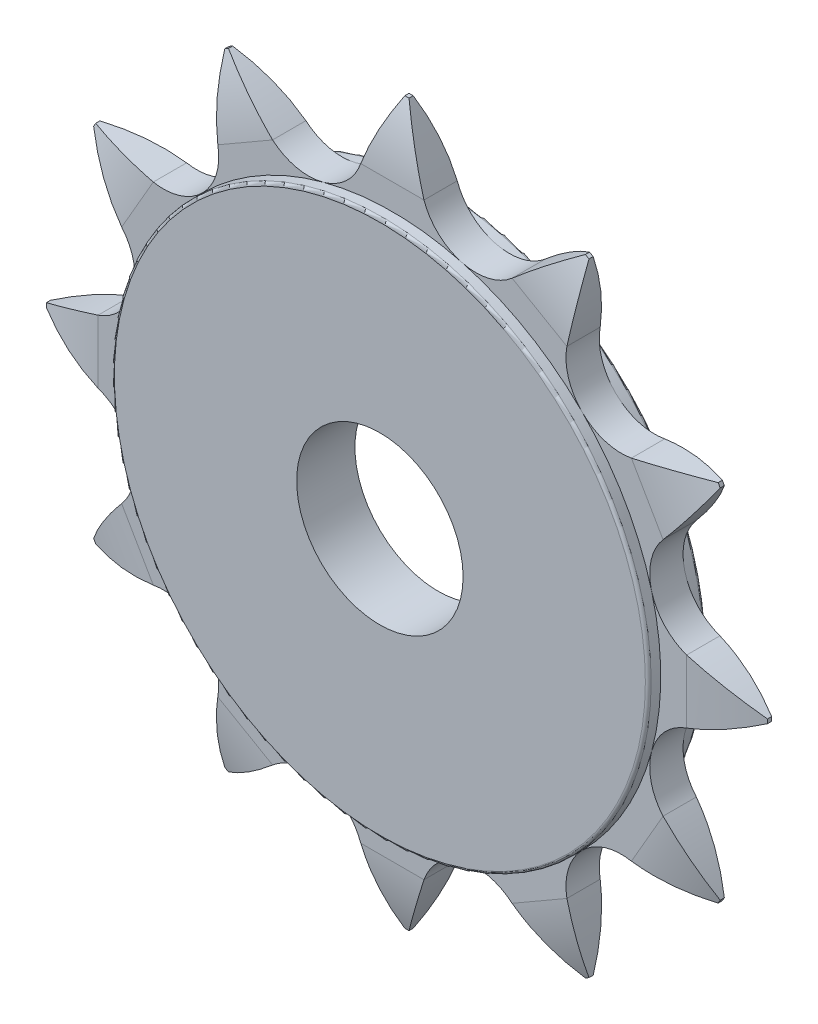
from build123d import *

# Parameters (mm, degrees)
EXTRUDE_1_DEPTH          = 2
CUT_EXTRUDE_1_DEPTH      = 6
PATTERN_CIRCULAR_1_COUNT = 12
SKETCH_6_R               = 32.25
SKETCH_6_R_2             = 10
EXTRUDE_2_DEPTH          = 3.5
FILLET_1_R               = 0.35


with BuildPart() as part:
    # Эскиз4 → Бобышка-Вытянуть1 (new, symmetric)
    with BuildSketch(Plane.XY):
        with BuildLine():
            Line((-0.25, 43.320508076), (0.25, 43.320508076))
            ThreePointArc((0.25, 43.320508076), (2.185336575, 39.411779528), (3.8, 35.360045512))
            ThreePointArc((3.8, 35.360045512), (5.552858836, 32.693174534), (8.346914205, 31.151107898))
            ThreePointArc((8.346914205, 31.151107898), (0, 32.25), (-8.346914205, 31.151107898))
            ThreePointArc((-8.346914205, 31.151107898), (-5.552858836, 32.693174534), (-3.8, 35.360045512))
            ThreePointArc((-3.8, 35.360045512), (-2.185336575, 39.411779528), (-0.25, 43.320508076))
        make_face()
    extrude(amount=EXTRUDE_1_DEPTH, both=True)

    # Эскиз5 → Вырез-Вытянуть1 (cut, symmetric)
    with BuildSketch(Plane(origin=(0, 0, 0), x_dir=(0, 0, -1), z_dir=(1, 0, 0))):
        with BuildLine():
            Line((-2, 35.360045512), (-3, 35.360045512))
            Line((-3, 35.360045512), (-3, 44.320508076))
            Line((-3, 44.320508076), (3, 44.320508076))
            Line((3, 44.320508076), (3, 35.360045512))
            Line((3, 35.360045512), (2, 35.360045512))
            ThreePointArc((2, 35.360045512), (1.451594964, 39.412074278), (0.25, 43.320508076))
            Line((0.25, 43.320508076), (-0.25, 43.320508076))
            ThreePointArc((-0.25, 43.320508076), (-1.451594964, 39.412074278), (-2, 35.360045512))
        make_face()
    extrude(amount=CUT_EXTRUDE_1_DEPTH, both=True, mode=Mode.SUBTRACT)


with BuildPart() as pattern_circular_1_1:
    # Круговой массив1: pattern copy
    add(part.part.rotate(Axis((0, 0, 0), (0, 0, 1)), 1 * 360 / PATTERN_CIRCULAR_1_COUNT))


with BuildPart() as pattern_circular_1_2:
    # Круговой массив1: pattern copy
    add(part.part.rotate(Axis((0, 0, 0), (0, 0, 1)), 2 * 360 / PATTERN_CIRCULAR_1_COUNT))


with BuildPart() as pattern_circular_1_3:
    # Круговой массив1: pattern copy
    add(part.part.rotate(Axis((0, 0, 0), (0, 0, 1)), 3 * 360 / PATTERN_CIRCULAR_1_COUNT))


with BuildPart() as pattern_circular_1_4:
    # Круговой массив1: pattern copy
    add(part.part.rotate(Axis((0, 0, 0), (0, 0, 1)), 4 * 360 / PATTERN_CIRCULAR_1_COUNT))


with BuildPart() as pattern_circular_1_5:
    # Круговой массив1: pattern copy
    add(part.part.rotate(Axis((0, 0, 0), (0, 0, 1)), 5 * 360 / PATTERN_CIRCULAR_1_COUNT))


with BuildPart() as pattern_circular_1_6:
    # Круговой массив1: pattern copy
    add(part.part.rotate(Axis((0, 0, 0), (0, 0, 1)), 6 * 360 / PATTERN_CIRCULAR_1_COUNT))


with BuildPart() as pattern_circular_1_7:
    # Круговой массив1: pattern copy
    add(part.part.rotate(Axis((0, 0, 0), (0, 0, 1)), 7 * 360 / PATTERN_CIRCULAR_1_COUNT))


with BuildPart() as pattern_circular_1_8:
    # Круговой массив1: pattern copy
    add(part.part.rotate(Axis((0, 0, 0), (0, 0, 1)), 8 * 360 / PATTERN_CIRCULAR_1_COUNT))


with BuildPart() as pattern_circular_1_9:
    # Круговой массив1: pattern copy
    add(part.part.rotate(Axis((0, 0, 0), (0, 0, 1)), 9 * 360 / PATTERN_CIRCULAR_1_COUNT))


with BuildPart() as pattern_circular_1_10:
    # Круговой массив1: pattern copy
    add(part.part.rotate(Axis((0, 0, 0), (0, 0, 1)), 10 * 360 / PATTERN_CIRCULAR_1_COUNT))


with BuildPart() as pattern_circular_1_11:
    # Круговой массив1: pattern copy
    add(part.part.rotate(Axis((0, 0, 0), (0, 0, 1)), 11 * 360 / PATTERN_CIRCULAR_1_COUNT))


with BuildPart() as part_1:
    add(part.part)

    add(pattern_circular_1_1.part)  # Бобышка-Вытянуть2 merges Круговой массив1_1

    add(pattern_circular_1_2.part)  # Бобышка-Вытянуть2 merges Круговой массив1_2

    add(pattern_circular_1_3.part)  # Бобышка-Вытянуть2 merges Круговой массив1_3

    add(pattern_circular_1_4.part)  # Бобышка-Вытянуть2 merges Круговой массив1_4

    add(pattern_circular_1_5.part)  # Бобышка-Вытянуть2 merges Круговой массив1_5

    add(pattern_circular_1_6.part)  # Бобышка-Вытянуть2 merges Круговой массив1_6

    add(pattern_circular_1_7.part)  # Бобышка-Вытянуть2 merges Круговой массив1_7

    add(pattern_circular_1_8.part)  # Бобышка-Вытянуть2 merges Круговой массив1_8

    add(pattern_circular_1_9.part)  # Бобышка-Вытянуть2 merges Круговой массив1_9

    add(pattern_circular_1_10.part)  # Бобышка-Вытянуть2 merges Круговой массив1_10

    add(pattern_circular_1_11.part)  # Бобышка-Вытянуть2 merges Круговой массив1_11
    # Эскиз6 → Бобышка-Вытянуть2 (add, symmetric)
    with BuildSketch(Plane.XY):
        Circle(SKETCH_6_R)
        Circle(SKETCH_6_R_2, mode=Mode.SUBTRACT)
    extrude(amount=EXTRUDE_2_DEPTH, both=True)

    # Скругление1
    fillet_1_edges = [part_1.edges().sort_by_distance(p)[0] for p in [
        (-32.25, 0, -3.5),
        (-32.25, 0, 3.5),
    ]]
    fillet(fillet_1_edges, radius=FILLET_1_R)


solid = part_1.part
